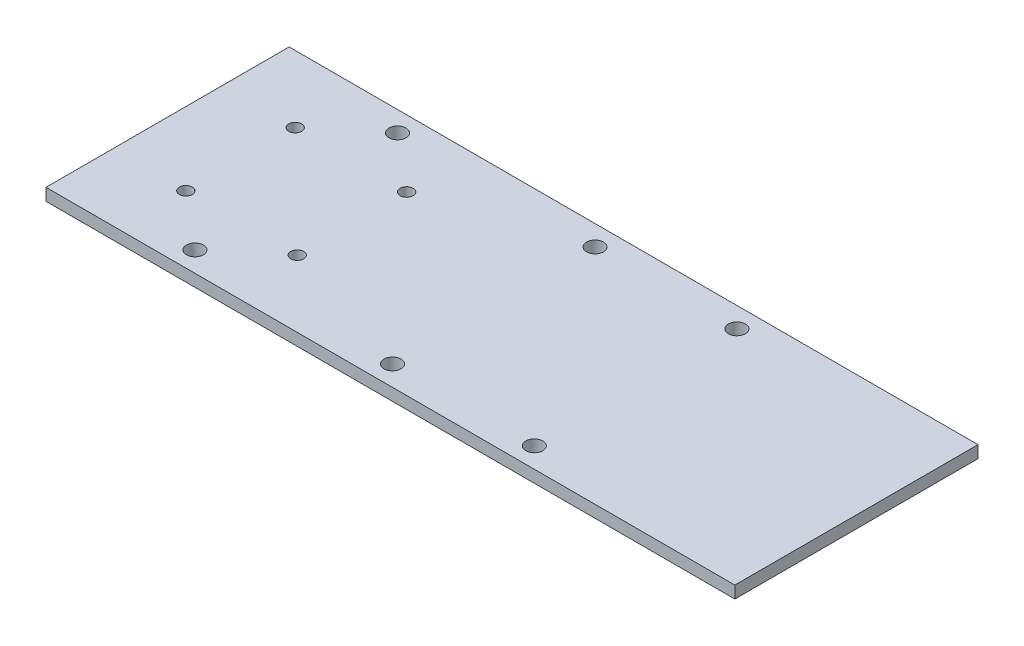
from build123d import *

# Parameters (mm, degrees)
SKETCH_1_W          = 170
SKETCH_1_H          = 60
EXTRUDE_1_DEPTH     = 3
SKETCH_2_R          = 1.6
SKETCH_2_R_2        = 2.1
CUT_EXTRUDE_1_DEPTH = 267.924326413


with BuildPart() as part:
    # 草图1 → 凸台-拉伸1 (new body)
    with BuildSketch(Plane(origin=(0, 0, 0), x_dir=(1, 0, 0), z_dir=(0, 1, 0))):
        with Locations((-161.441364286, 72.5)):
            Rectangle(SKETCH_1_W, SKETCH_1_H)
    extrude(amount=EXTRUDE_1_DEPTH)

    # 草图2 → 切除-拉伸1 (cut, through all)
    with BuildSketch(Plane(origin=(0, 3, 0), x_dir=(1, 0, 0), z_dir=(0, 1, 0))):
        with Locations(Location((-228.441364286, 86, 0), (0, 0, 270))):
            Circle(SKETCH_2_R)
        with Locations(Location((-228.441364286, 59, 0), (0, 0, 270))):
            Circle(SKETCH_2_R)
        with Locations(Location((-200.941364286, 86, 0), (0, 0, 270))):
            Circle(SKETCH_2_R)
        with Locations(Location((-200.941364286, 59, 0), (0, 0, 90))):
            Circle(SKETCH_2_R)
        with Locations(Location((-130.941364286, 97.5, 0), (0, 0, 270))):
            Circle(SKETCH_2_R_2)
        with Locations(Location((-165.941364286, 97.5, 0), (0, 0, 270))):
            Circle(SKETCH_2_R_2)
        with Locations(Location((-130.941364286, 47.5, 0), (0, 0, 90))):
            Circle(SKETCH_2_R_2)
        with Locations(Location((-165.941364286, 47.5, 0), (0, 0, 90))):
            Circle(SKETCH_2_R_2)
        with Locations(Location((-214.691364286, 97.5, 0), (0, 0, 270))):
            Circle(SKETCH_2_R_2)
        with Locations(Location((-214.691364286, 47.5, 0), (0, 0, 90))):
            Circle(SKETCH_2_R_2)
    extrude(amount=-CUT_EXTRUDE_1_DEPTH, mode=Mode.SUBTRACT)


solid = part.part
